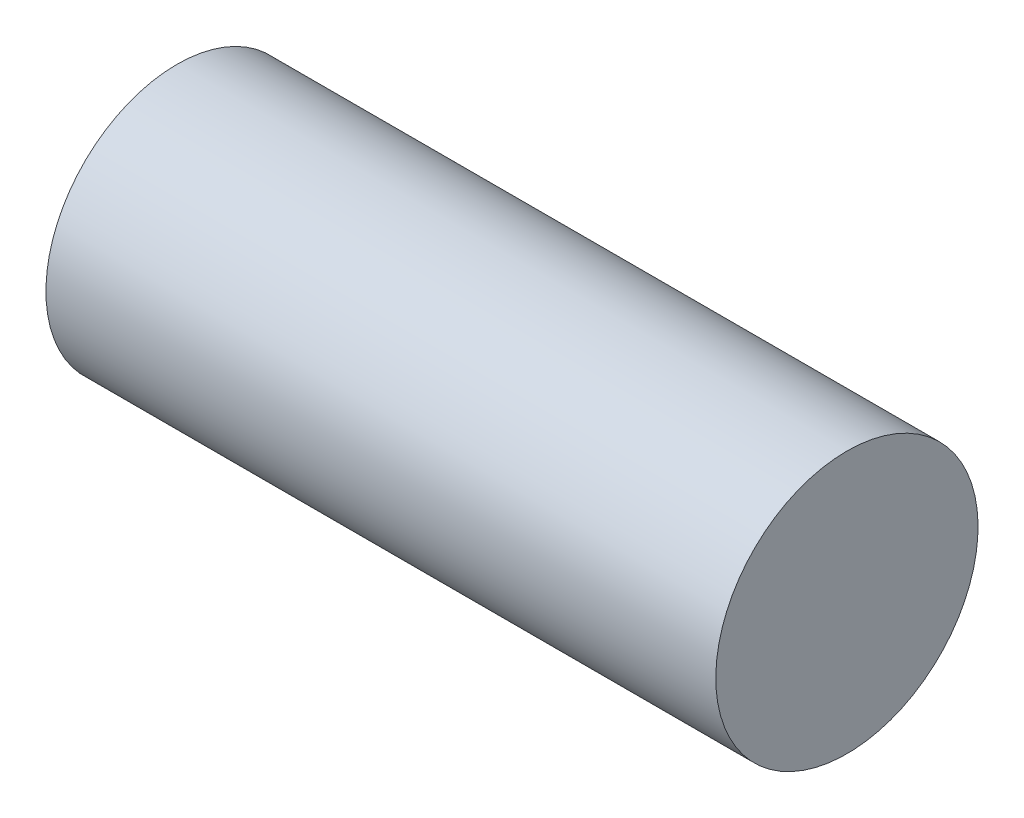
from build123d import *

# Parameters (mm, degrees)
BOSS_EXTRUDE1_START = 0.2
BOSS_EXTRUDE1_DEPTH = 17
BOSS_EXTRUDE2_START = 0.825
SKETCH1_3_R         = 3.45
BOSS_EXTRUDE2_DEPTH = 0.825


with BuildPart() as part:
    # Sketch1 → Boss-Extrude1 (new body)
    # profile 1 of 2: a face of its own
    with BuildSketch(Plane(origin=(7.999998093, 0, 0), x_dir=(0, 0, -1), z_dir=(1, 0, 0)).offset(BOSS_EXTRUDE1_START)):
        with BuildLine():
            Line((23.853743883, -20.744040957), (20.276035119, -20.744040824))
            ThreePointArc((20.276035119, -20.744040824), (18.742240101, -16.865331986), (22.06488974, -14.344040891))
            ThreePointArc((22.06488974, -14.344040891), (25.387539191, -16.865332234), (23.853743883, -20.744040957))
        make_face()
        with BuildLine():
            ThreePointArc((23.61408287, -19.944040948), (24.586793684, -16.980099955), (22.06488971, -15.144040891))
            ThreePointArc((22.06488971, -15.144040891), (19.542985599, -16.980099767), (20.515696193, -19.944040833))
            Line((20.515696193, -19.944040833), (23.61408287, -19.944040948))
        make_face(mode=Mode.SUBTRACT)
    # profile 2 of 2: a face of its own
    with BuildSketch(Plane(origin=(7.999998093, 0, 0), x_dir=(0, 0, -1), z_dir=(1, 0, 0)).offset(BOSS_EXTRUDE1_START)):
        with BuildLine():
            ThreePointArc((20.276035119, -20.744040824), (22.064889483, -21.244040891), (23.853743883, -20.744040957))
            Line((23.853743883, -20.744040957), (20.276035119, -20.744040824))
        make_face()
    extrude(amount=-BOSS_EXTRUDE1_DEPTH)

    # Sketch1<3> → Boss-Extrude2 (add)
    with BuildSketch(Plane(origin=(7.999998093, 0, 0), x_dir=(0, 0, -1), z_dir=(1, 0, 0)).offset(BOSS_EXTRUDE2_START)):
        with Locations(Location((22.064889611, -17.794040891, 0), (0, 0, 90))):
            Circle(SKETCH1_3_R)
        with BuildLine():
            Line((23.853743883, -20.744040957), (20.276035119, -20.744040824))
            ThreePointArc((20.276035119, -20.744040824), (18.742240101, -16.865331986), (22.06488974, -14.344040891))
            ThreePointArc((22.06488974, -14.344040891), (25.387539191, -16.865332234), (23.853743883, -20.744040957))
        make_face()
    extrude(amount=-BOSS_EXTRUDE2_DEPTH)


solid = part.part
